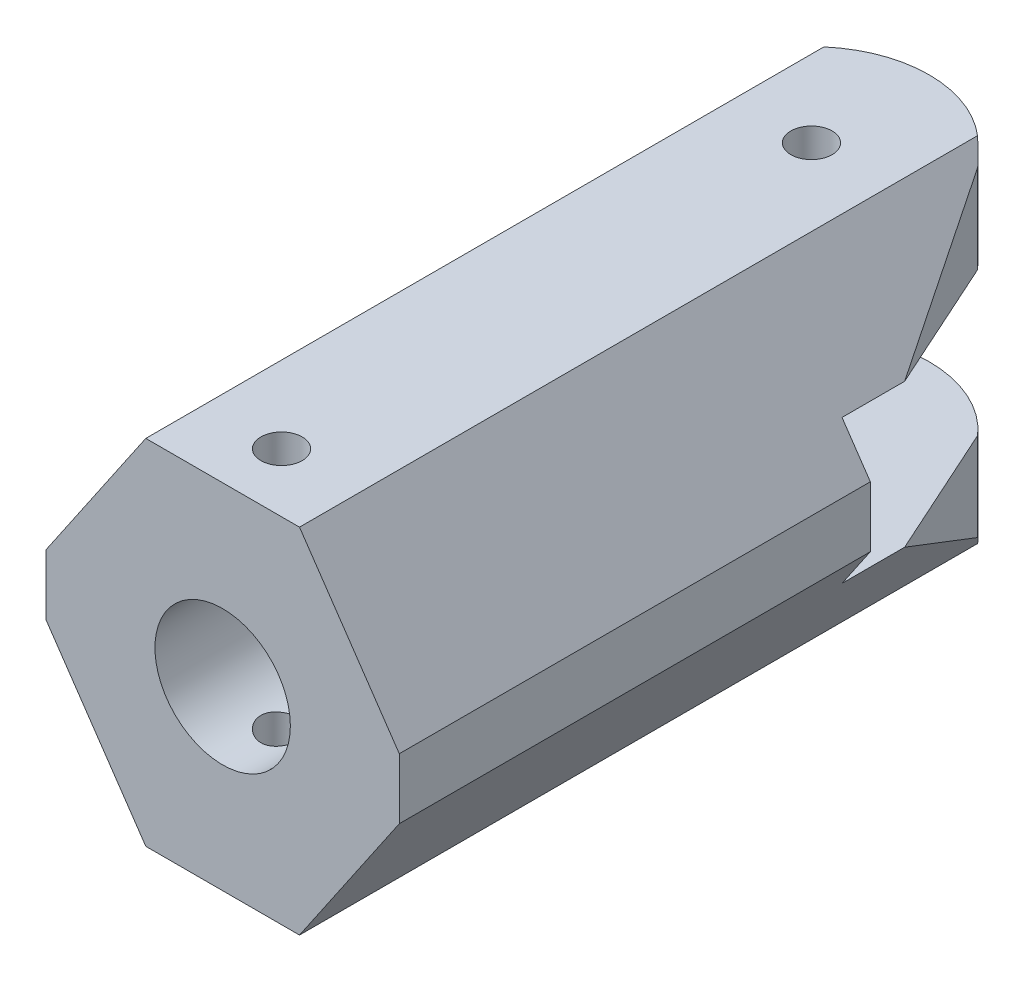
from build123d import *

# Parameters (mm, degrees)
SKETCH3_W            = 30
SKETCH3_H            = 30
BOSS_EXTRUDE1_DEPTH  = 40
CUT_EXTRUDE1_DEPTH   = 10
SKETCH5_R            = 3.58
CUT_EXTRUDE2_DEPTH   = 5
CUT_EXTRUDE4_START   = -40
CUT_EXTRUDE4_DEPTH   = 99.309518948
MIRROR5_START        = -40
MIRROR5_COPY_1_DEPTH = 99.309518948
SKETCH9_R            = 1.75
BOSS_EXTRUDE2_DEPTH  = 30
CUT_EXTRUDE5_DEPTH   = 30
SKETCH11_W           = 20
SKETCH11_H           = 12.2
CUT_EXTRUDE6_DEPTH   = 44.5
SKETCH15_R           = 1.75
CUT_EXTRUDE8_DEPTH   = 25


with BuildPart() as part:
    # Sketch3 → Boss-Extrude1 (new body)
    with BuildSketch(Plane.XY):
        with Locations((15, 15)):
            Rectangle(SKETCH3_W, SKETCH3_H)
    extrude(amount=BOSS_EXTRUDE1_DEPTH)

    # Sketch4 → Cut-Extrude1 (cut)
    with BuildSketch(Plane.XY.offset(40)):
        with BuildLine():
            ThreePointArc((20.75, 15), (17.200429736, 20.312307312), (10.934136008, 19.065863992))
            Line((10.934136008, 19.065863992), (19.065863992, 10.934136008))
            ThreePointArc((19.065863992, 10.934136008), (20.312307312, 12.799570264), (20.75, 15))
        make_face()
        with BuildLine():
            Line((19.065863992, 10.934136008), (10.934136008, 19.065863992))
            ThreePointArc((10.934136008, 19.065863992), (10.934136008, 10.934136008), (19.065863992, 10.934136008))
        make_face()
    extrude(amount=-CUT_EXTRUDE1_DEPTH, mode=Mode.SUBTRACT)

    # Sketch5 → Cut-Extrude2 (cut)
    with BuildSketch(Plane.XZ):
        with Locations(Location((15, 35, 0), (0, 0, 270))):
            Circle(SKETCH5_R)
    extrude(amount=-CUT_EXTRUDE2_DEPTH, mode=Mode.SUBTRACT)

    # Sketch8 → Cut-Extrude4 (cut)
    with BuildSketch(Plane(origin=(0, 0, 0), x_dir=(-1, 0, 0), z_dir=(0, 0, -1)).offset(CUT_EXTRUDE4_START)):
        Polygon((-77.236567429, -51.703622198), (-30, 17.572977849), (-21.526577959, 30), (25.70998947, 99.276600047), (-112.843210625, 193.749734905), (-215.789767524, 42.769512659), align=None)
    cut_extrude4 = extrude(amount=CUT_EXTRUDE4_DEPTH, mode=Mode.SUBTRACT)

    # Mirror4: Cut-Extrude4 across plane
    add(cut_extrude4.mirror(Plane.ZY.offset(-15)), mode=Mode.SUBTRACT)

    # Mirror5: Cut-Extrude4 across plane
    add(cut_extrude4.mirror(Plane(origin=(0, 15, 0), x_dir=(0, 0, 1), z_dir=(0, -1, 0))), mode=Mode.SUBTRACT)

    # Mirror5 copy 1 sketch → Mirror5 copy 1 (cut)
    with BuildSketch(Plane(origin=(30, 30, 0), x_dir=(1, 0, 0), z_dir=(0, 0, -1)).offset(MIRROR5_START)):
        Polygon((-77.236567429, -51.703622198), (-30, 17.572977849), (-21.526577959, 30), (25.70998947, 99.276600047), (-112.843210625, 193.749734905), (-215.789767524, 42.769512659), align=None)
    extrude(amount=MIRROR5_COPY_1_DEPTH, mode=Mode.SUBTRACT)

    # Sketch9 → Boss-Extrude2 (add)
    with BuildSketch(Plane(origin=(0, 0, 0), x_dir=(1, 0, 0), z_dir=(0, 1, 0))):
        with BuildLine():
            Line((5.769230769, 13.846153846), (0, 0))
            Line((0, 0), (30, 0))
            Line((30, 0), (24.924823528, 11.223878236))
            Line((24.924823528, 11.223878236), (22.474176558, 16.643544594))
            ThreePointArc((22.474176558, 16.643544594), (13.348408887, 19.862669355), (5.769230769, 13.846153846))
        make_face()
        with Locations(Location((15, 10, 0), (0, 0, 270))):
            Circle(SKETCH9_R, mode=Mode.SUBTRACT)
    extrude(amount=BOSS_EXTRUDE2_DEPTH)

    # Sketch10 → Cut-Extrude5 (cut)
    with BuildSketch(Plane.XY):
        Polygon((0, 17.572977849), (8.473422041, 30), (0, 30), align=None)
        Polygon((8.473422041, 0), (0, 0), (0, 12.427022151), align=None)
        Polygon((21.526577959, 0), (30, 12.427022151), (30, 0), align=None)
        Polygon((30, 17.572977849), (21.526577959, 30), (30, 30), align=None)
    extrude(amount=-CUT_EXTRUDE5_DEPTH, mode=Mode.SUBTRACT)

    # Sketch11 → Cut-Extrude6 (cut, symmetric)
    with BuildSketch(Plane(origin=(30, 0, 0), x_dir=(0, 0, -1), z_dir=(1, 0, 0))):
        with Locations((10, 15)):
            Rectangle(SKETCH11_W, SKETCH11_H)
    extrude(amount=CUT_EXTRUDE6_DEPTH, both=True, mode=Mode.SUBTRACT)

    # Sketch15 → Cut-Extrude8 (cut)
    with BuildSketch(Plane.XZ.offset(-5)):
        with Locations(Location((15, 35, 0), (0, 0, 270))):
            Circle(SKETCH15_R)
    extrude(amount=-CUT_EXTRUDE8_DEPTH, mode=Mode.SUBTRACT)


solid = part.part
